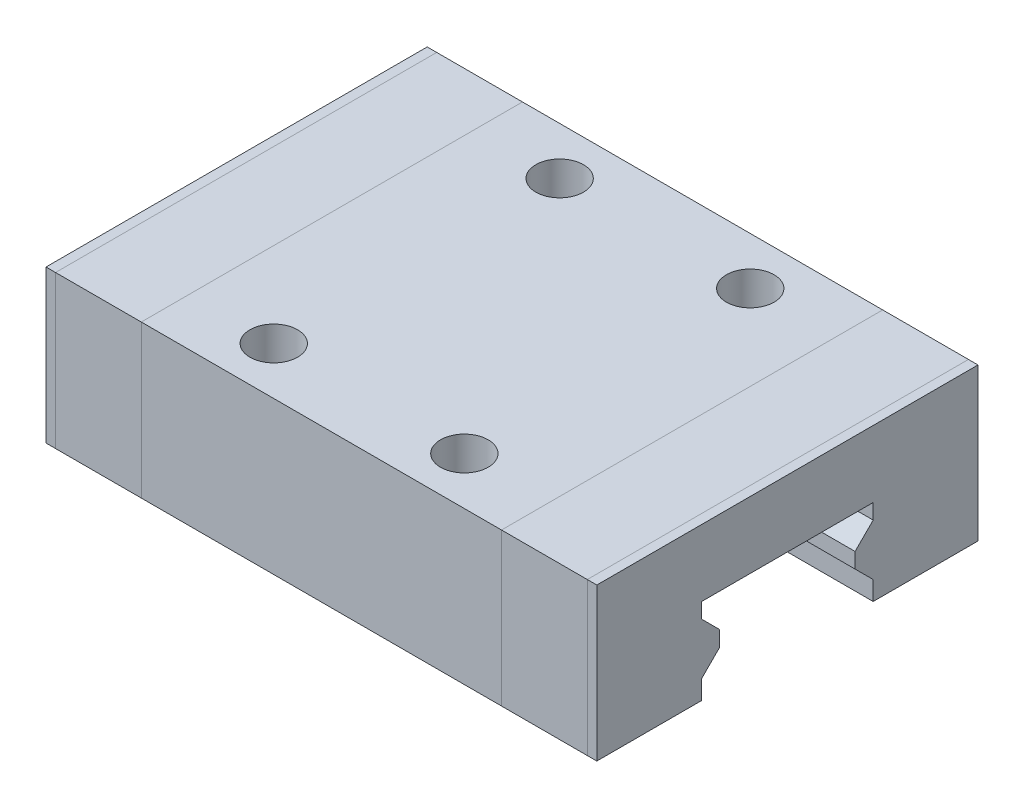
from build123d import *

# Parameters (mm, degrees)
SKETCH_1_W             = 28.9
SKETCH_1_H             = 20
EXTRUDE_1_DEPTH        = 8
CUT_EXTRUDE_1_DEPTH    = 32.610283137
HOLE_WIZARD_M3_1_D     = 2.5
HOLE_WIZARD_M3_1_DEPTH = 3
HOLE_WIZARD_M3_1_TIP   = 0.751075774


with BuildPart() as part:
    # 草图1 → 凸台-拉伸1 (new body)
    with BuildSketch(Plane(origin=(0, 0, 0), x_dir=(1, 0, 0), z_dir=(0, 1, 0))):
        Rectangle(SKETCH_1_W, SKETCH_1_H)
    extrude(amount=EXTRUDE_1_DEPTH)

    # 草图2 → 切除-拉伸1 (cut, through all)
    with BuildSketch(Plane.ZY.offset(14.45)):
        Polygon((-4.5, 0), (-4.5, 1), (-3.55, 1.95), (-3.55, 2.75), (-4.5, 3.7), (-4.5, 4.5), (4.5, 4.5), (4.5, 3.7), (3.55, 2.75), (3.55, 1.95), (4.5, 1), (4.5, 0), align=None)
    extrude(amount=-CUT_EXTRUDE_1_DEPTH, mode=Mode.SUBTRACT)

    # M3 螺纹孔1
    with Locations(Plane(origin=(0, 8, 0), x_dir=(1, 0, 0), z_dir=(0, 1, 0))):
        with Locations((-5, -7.5), (5, -7.5), (5, 7.5), (-5, 7.5)):
            Hole(HOLE_WIZARD_M3_1_D / 2, depth=HOLE_WIZARD_M3_1_DEPTH)
            with Locations((0, 0, -(HOLE_WIZARD_M3_1_DEPTH + HOLE_WIZARD_M3_1_TIP / 2))):  # 118° drill point
                Cone(0, HOLE_WIZARD_M3_1_D / 2, HOLE_WIZARD_M3_1_TIP, mode=Mode.SUBTRACT)


solid = part.part
